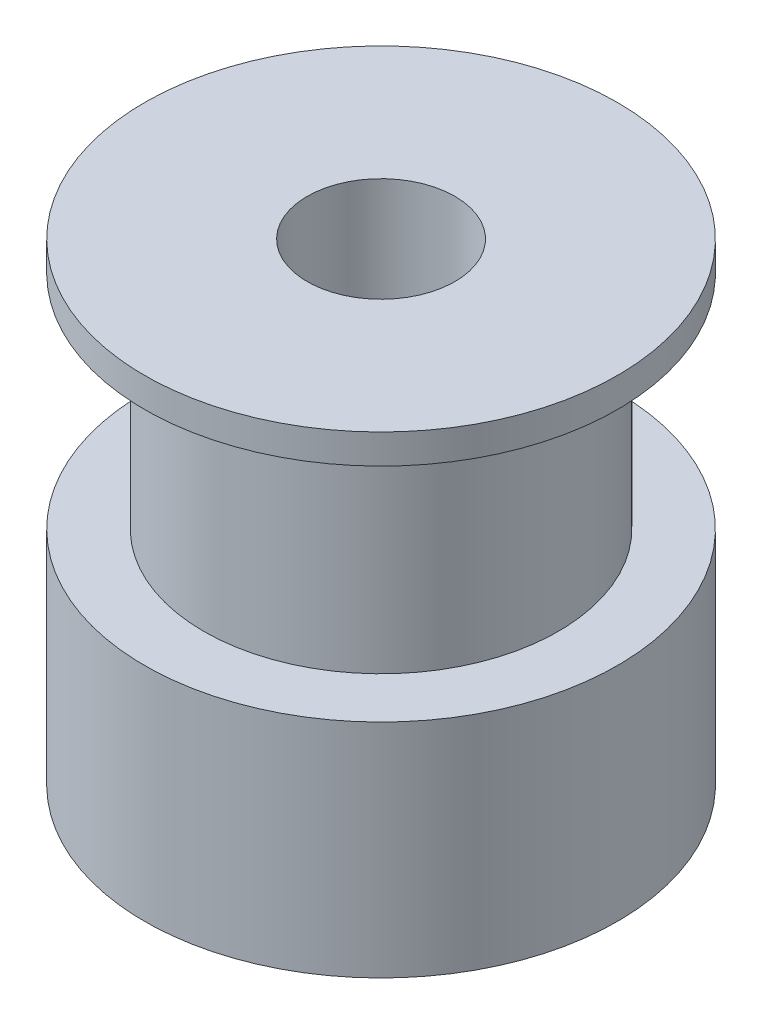
from build123d import *


with BuildPart() as part:
    # Sketch1 → Revolve1 (revolve)
    with BuildSketch(Plane.XY, mode=Mode.PRIVATE) as revolve1_sk:
        Polygon((8, 0), (8, 7.5), (6, 7.5), (6, 15), (8, 15), (8, 16), (2.5, 16), (2.5, 0), align=None)
    revolve(revolve1_sk.sketch.rotate(Axis((0, 0, 0), (0, 1, 0)), 90), axis=Axis((0, 0, 0), (0, 1, 0)))


solid = part.part
